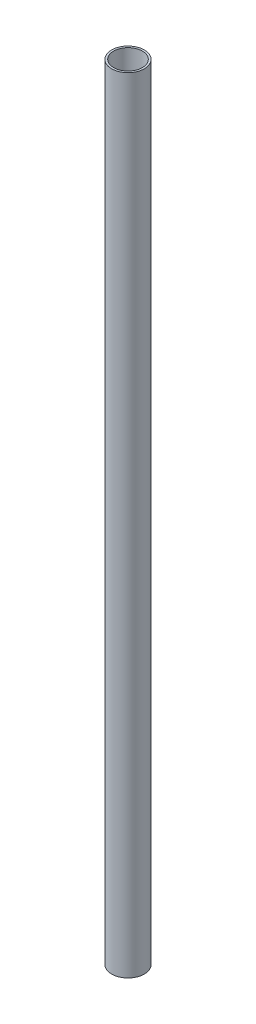
from build123d import *

# Parameters (mm, degrees)
SKETCH_2_R      = 12.5
SKETCH_2_R_2    = 11
EXTRUDE_1_DEPTH = 300


with BuildPart() as part:
    # 草图2 → 凸台-拉伸1 (new, symmetric)
    with BuildSketch(Plane(origin=(0, 0, 0), x_dir=(1, 0, 0), z_dir=(0, 1, 0))):
        with Locations(Location((0, 0, 0), (0, 0, 270))):
            Circle(SKETCH_2_R)
        with Locations(Location((0, 0, 0), (0, 0, 270))):
            Circle(SKETCH_2_R_2, mode=Mode.SUBTRACT)
    extrude(amount=EXTRUDE_1_DEPTH, both=True)


solid = part.part
